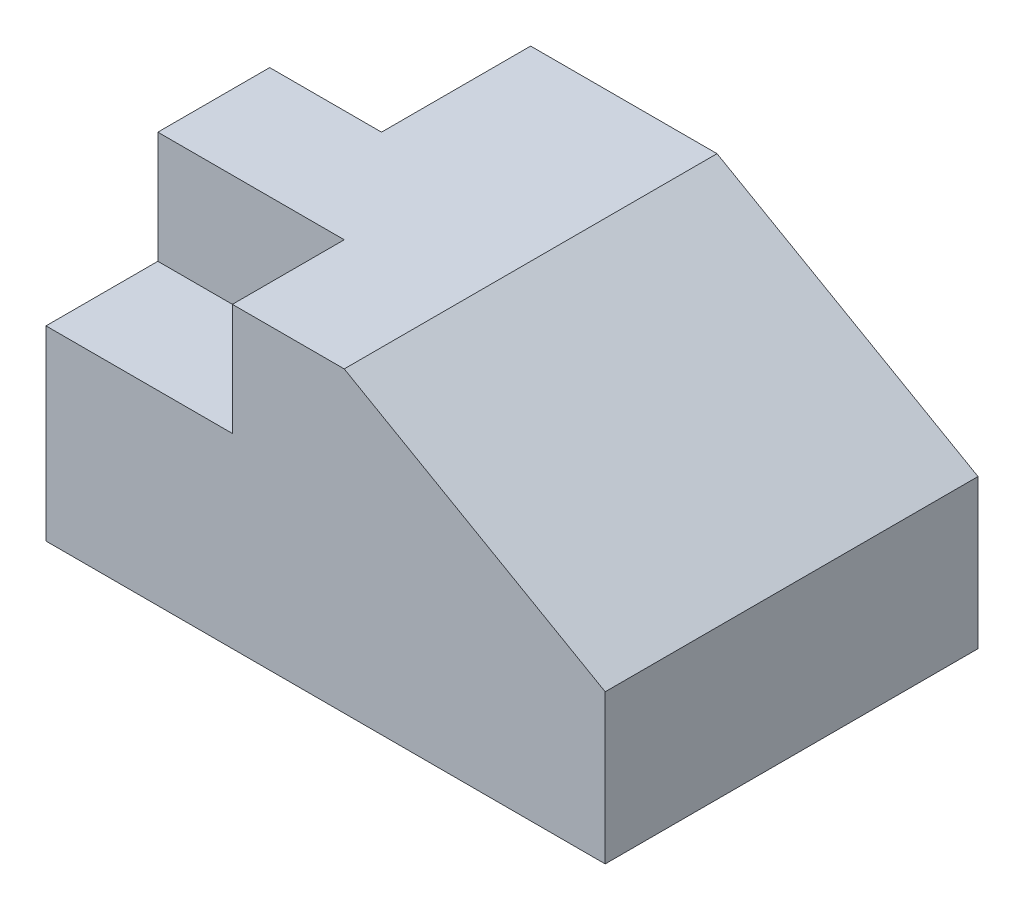
from build123d import *

# Parameters (mm, degrees)
SKETCH1_W           = 50
SKETCH1_H           = 30
BOSS_EXTRUDE1_DEPTH = 50
SKETCH2_W           = 30
SKETCH2_H           = 40
SKETCH2_W_2         = 50
SKETCH2_H_2         = 30
CUT_EXTRUDE1_DEPTH  = 30


with BuildPart() as part:
    # Sketch1 → Boss-Extrude1 (new, symmetric)
    with BuildSketch(Plane.XY):
        with Locations((25, 65)):
            Rectangle(SKETCH1_W, SKETCH1_H)
        Polygon((0, 50), (0, 0), (150, 0), (150, 40), (80, 80), (50, 80), (50, 50), align=None)
    extrude(amount=BOSS_EXTRUDE1_DEPTH, both=True)

    # Sketch2 → Cut-Extrude1 (cut)
    with BuildSketch(Plane(origin=(0, 80, 0), x_dir=(1, 0, 0), z_dir=(0, 1, 0))):
        with Locations((15, 30)):
            Rectangle(SKETCH2_W, SKETCH2_H)
        with Locations((25, -35)):
            Rectangle(SKETCH2_W_2, SKETCH2_H_2)
    extrude(amount=-CUT_EXTRUDE1_DEPTH, mode=Mode.SUBTRACT)


solid = part.part
